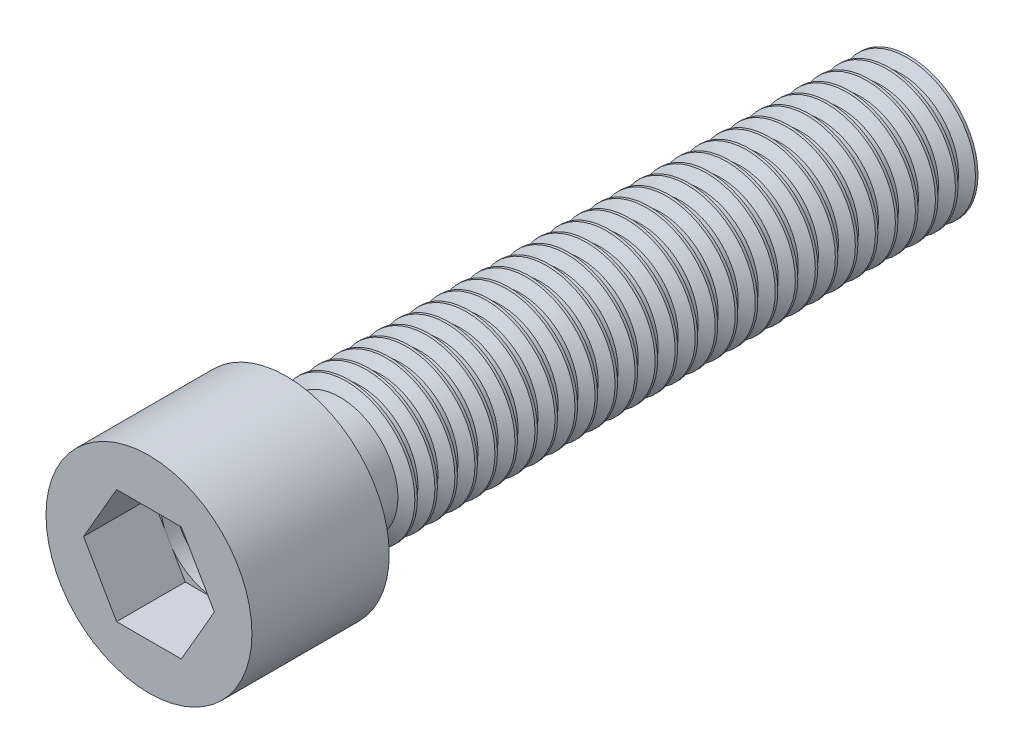
from build123d import *

# Parameters (mm, degrees)
SKETCH1_R          = 5.059375052
BASE_EXTRUDE_DEPTH = 55
LPATTERN1_COUNT    = 29
LPATTERN1_PITCH    = 1.750000054
SKETCH7_W          = 8.999999613
SKETCH7_H          = 12.000000104
CUT_EXTRUDE2_DEPTH = 6.000000052


with BuildPart() as part:
    # Sketch1 → Base-Extrude (new body)
    with BuildSketch(Plane.XY):
        Circle(SKETCH1_R)
    extrude(amount=BASE_EXTRUDE_DEPTH)

    # Boss-Sweep1: sweep along a path in Sketch4
    with BuildLine(Plane(origin=(0, 0, 0.5), x_dir=(-1, 0, 0), z_dir=(0, 0, -1))) as boss_sweep1_path:
        CenterArc((0, 0), 5.059375052, 0, 360)
    # Sketch2 → Boss-Sweep1 (sweep)
    with BuildSketch(Plane(origin=(0, 0, 0), x_dir=(1, 0, 0), z_dir=(0, 1, 0))):
        Polygon((5.059375052, 0), (6.000000052, -0.543070097), (6.000000052, -0.761820104), (5.059375052, -1.304890201), align=None)
    boss_sweep1 = sweep(path=boss_sweep1_path.line)

    # LPattern1: Boss-Sweep1 ×29
    with Locations(*[(0, 0, i * LPATTERN1_PITCH) for i in range(1, LPATTERN1_COUNT)]):
        add(boss_sweep1)

    # Sketch7 → Boss-Revolve2 (revolve)
    with BuildSketch(Plane(origin=(0, 0, 0), x_dir=(1, 0, 0), z_dir=(0, 1, 0))):
        with Locations((4.499999806, -61.000000052)):
            Rectangle(SKETCH7_W, SKETCH7_H)
    revolve(axis=Axis((0, 0, 0), (0, 0, 1)))

    # Sketch8 → Cut-Extrude2 (cut)
    with BuildSketch(Plane.XY.offset(67.000000104)):
        Polygon((-2.828248696, 4.999999888), (2.828248696, 4.999999888), (5.714999977, 0), (2.828248696, -4.999999888), (-2.828248696, -4.999999888), (-5.714999977, 0), align=None)
    extrude(amount=-CUT_EXTRUDE2_DEPTH, mode=Mode.SUBTRACT)

    # Sketch9 → Cut-Revolve1 (revolve, cut)
    with BuildSketch(Plane(origin=(0, 0, 0), x_dir=(1, 0, 0), z_dir=(0, 1, 0))):
        Polygon((0, -61.000000052), (4.999999888, -61.000000052), (4.999999888, -59.799999995), (0, -58.460254063), align=None)
    revolve(axis=Axis((0, 0, 0), (0, 0, 1)), mode=Mode.SUBTRACT)


solid = part.part
